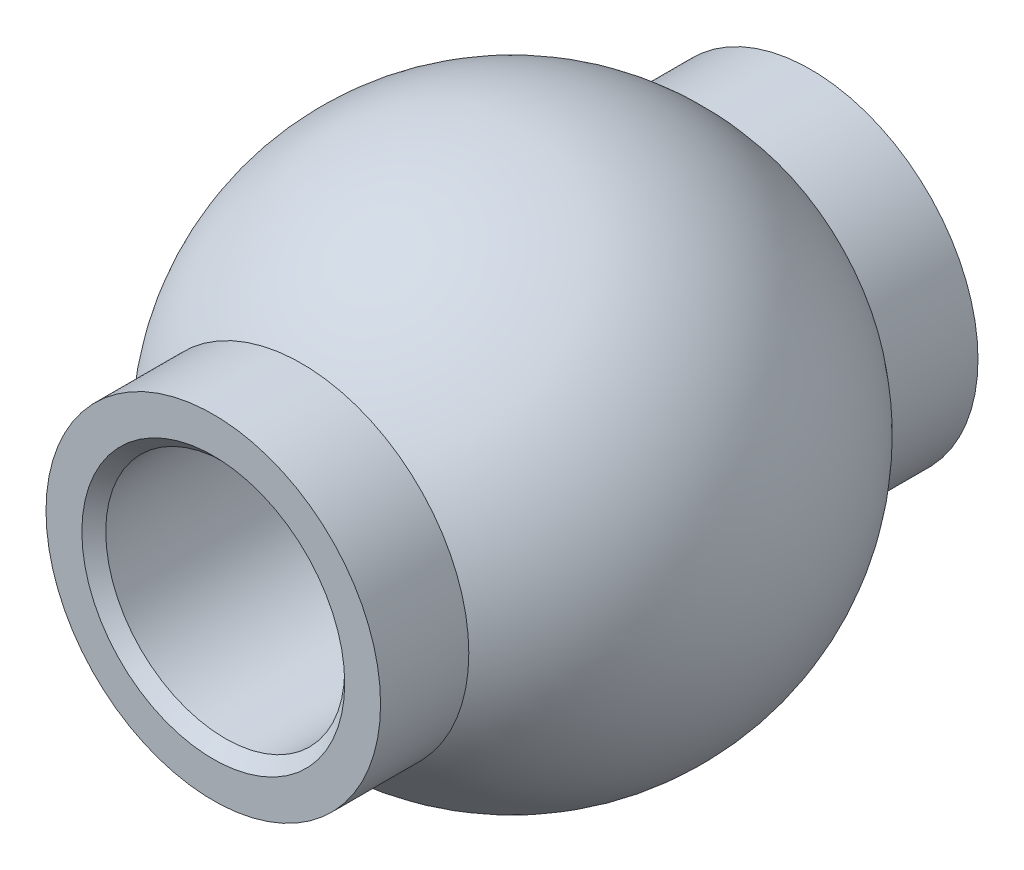
from build123d import *

# Parameters (mm, degrees)
CUT_EXTRUDE4_DEPTH      = 45.534963442
CUT_EXTRUDE4_DEPTH_BACK = 45.534963442
SKETCH10_R              = 6.35
SKETCH12_R              = 8.89
SKETCH12_R_2            = 6.35
EXTRUDE1_DEPTH          = 15.875
CHAMFER1_SIZE           = 0.635


with BuildPart() as part:
    # Sketch7 → Revolve3 (revolve)
    with BuildSketch(Plane.XY):
        with BuildLine():
            Line((0, 39.6875), (0, 11.1125))
            ThreePointArc((0, 11.1125), (14.2875, 25.4), (0, 39.6875))
        make_face()
    revolve(axis=Axis((0, 0, 0), (0, 1, 0)))

    # Sketch10 → Cut-Extrude4 (cut, two sides: drawn at the far end of the back side and taken through both)
    with BuildSketch(Plane.XY.offset(-CUT_EXTRUDE4_DEPTH_BACK)):
        with Locations((0, 25.4)):
            Circle(SKETCH10_R)
    extrude(amount=CUT_EXTRUDE4_DEPTH + CUT_EXTRUDE4_DEPTH_BACK, mode=Mode.SUBTRACT)

    # Sketch12 → Extrude1 (add, symmetric)
    with BuildSketch(Plane.XY):
        with Locations(Location((0, 25.4, 0), (0, 0, 180))):
            Circle(SKETCH12_R)
        with Locations((0, 25.4)):
            Circle(SKETCH12_R_2, mode=Mode.SUBTRACT)
    extrude(amount=EXTRUDE1_DEPTH, both=True)

    # Chamfer1
    chamfer1_edges = [part.edges().sort_by_distance(p)[0] for p in [
        (-6.35, 25.4, -15.875),
        (-6.35, 25.4, 15.875),
    ]]
    chamfer(chamfer1_edges, length=CHAMFER1_SIZE)


solid = part.part
